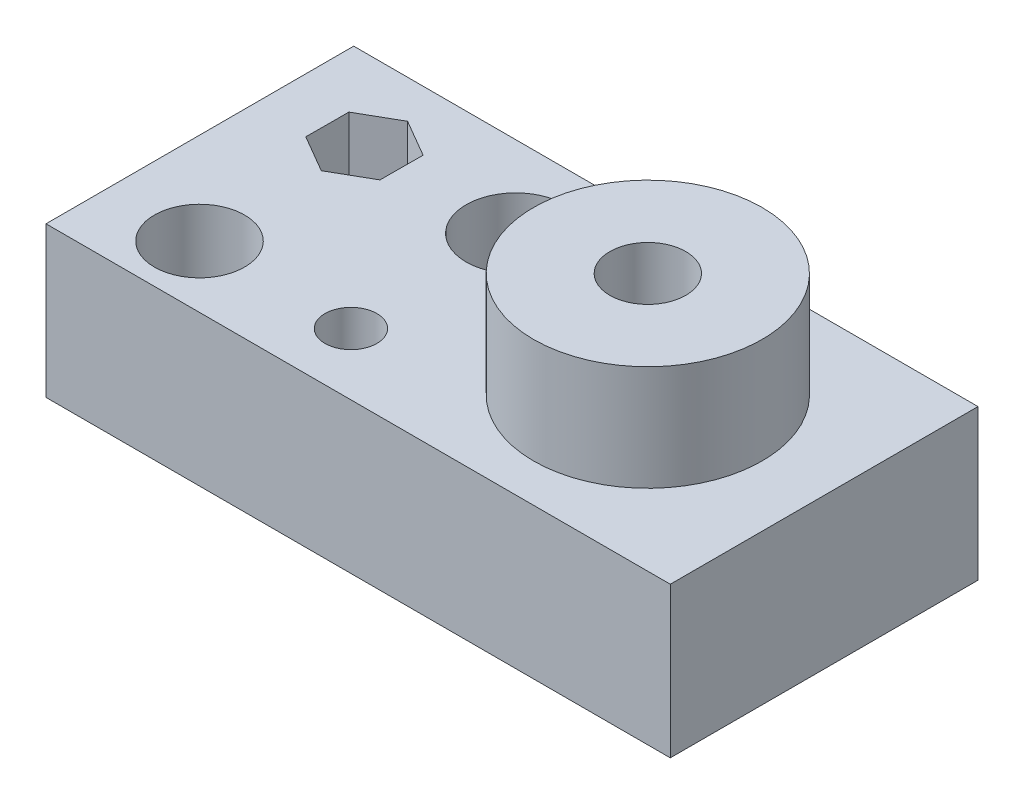
from build123d import *

# Parameters (mm, degrees)
SKETCH1_W           = 41.509557428
SKETCH1_H           = 20.45985577
SKETCH1_R           = 3
SKETCH1_R_2         = 3.3
SKETCH1_R_3         = 1.725
BOSS_EXTRUDE1_DEPTH = 10
SKETCH2_R           = 7.6
BOSS_EXTRUDE2_DEPTH = 7
SKETCH3_R           = 2.525
CUT_EXTRUDE1_DEPTH  = 43.062691409


with BuildPart() as part:
    # Sketch1 → Boss-Extrude1 (new body)
    with BuildSketch(Plane(origin=(0, 0, 0), x_dir=(1, 0, 0), z_dir=(0, 1, 0))):
        with Locations((14.647059063, -4.835923918)):
            Rectangle(SKETCH1_W, SKETCH1_H)
        with Locations(Location((-0.01006999, -10.957446633, 0), (0, 0, 270))):
            Circle(SKETCH1_R, mode=Mode.SUBTRACT)
        with Locations(Location((10.060612969, 0, 0), (0, 0, 270))):
            Circle(SKETCH1_R_2, mode=Mode.SUBTRACT)
        with Locations(Location((10.060612969, -10.957446633, 0), (0, 0, 270))):
            Circle(SKETCH1_R_3, mode=Mode.SUBTRACT)
        Polygon((2.480175999, 1.419939088), (0.010384677, 2.857864965), (-2.469791322, 1.437925877), (-2.480175999, -1.419939088), (-0.010384677, -2.857864965), (2.469791322, -1.437925877), align=None, mode=Mode.SUBTRACT)
    extrude(amount=BOSS_EXTRUDE1_DEPTH)

    # Sketch2 → Boss-Extrude2 (add)
    with BuildSketch(Plane(origin=(0, 10, 0), x_dir=(1, 0, 0), z_dir=(0, 1, 0))):
        with Locations(Location((23.760138251, -4.917169795, 0), (0, 0, 270))):
            Circle(SKETCH2_R)
    extrude(amount=BOSS_EXTRUDE2_DEPTH)

    # Sketch3 → Cut-Extrude1 (cut, through all)
    with BuildSketch(Plane(origin=(0, 17, 0), x_dir=(1, 0, 0), z_dir=(0, 1, 0))):
        with Locations(Location((23.760138251, -4.917169795, 0), (0, 0, 270))):
            Circle(SKETCH3_R)
    extrude(amount=-CUT_EXTRUDE1_DEPTH, mode=Mode.SUBTRACT)


solid = part.part
